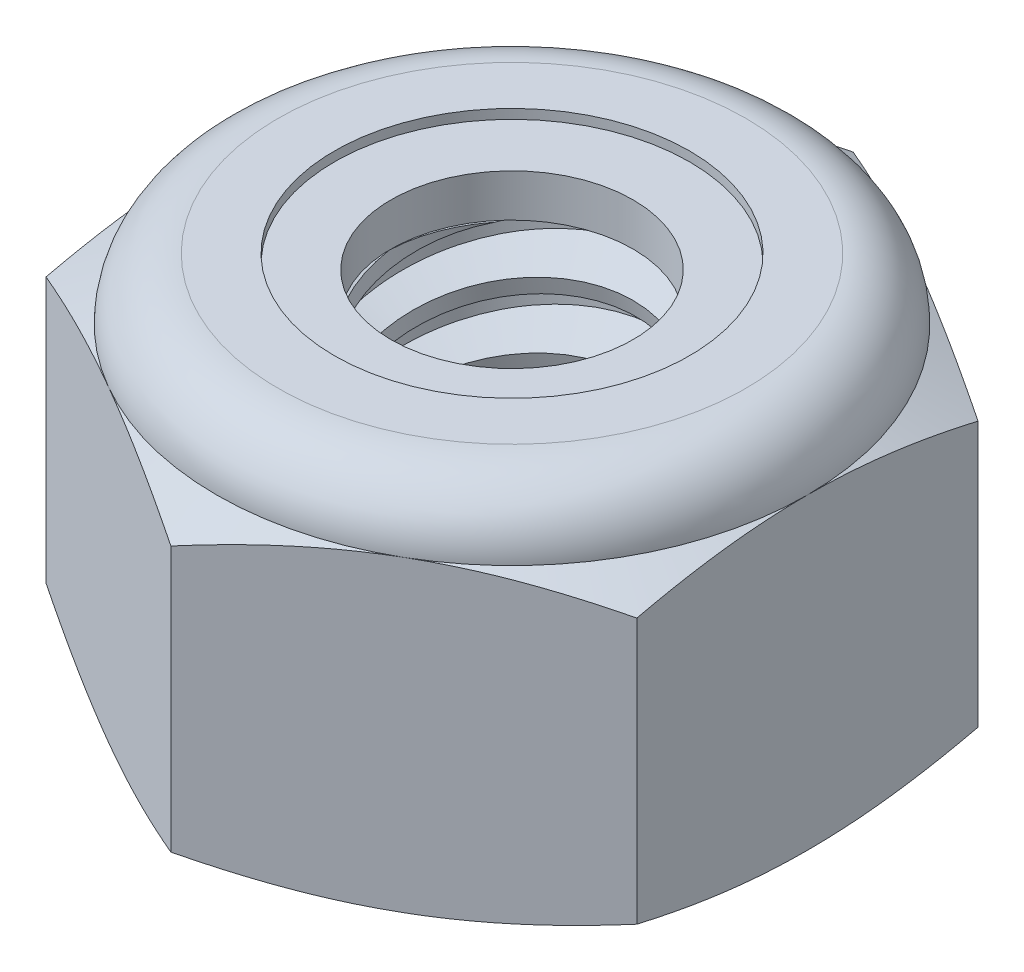
from build123d import *

# Parameters (mm, degrees)
EXTRUDE1_DEPTH      = 5.953125
SKETCH2_W           = 2.413
SKETCH2_H           = 5.953125
LPATTERN1_COUNT     = 6
LPATTERN1_PITCH     = 1.058333333
LPATTERN1_COL_COUNT = 2
LPATTERN1_COL_PITCH = 1.058333333


with BuildPart() as part:
    # Sketch1 → Extrude1 (new body)
    with BuildSketch(Plane(origin=(0, 0, 0), x_dir=(1, 0, 0), z_dir=(0, 1, 0))):
        Polygon((0, 5.499261314), (-4.7625, 2.749630657), (-4.7625, -2.749630657), (0, -5.499261314), (4.7625, -2.749630657), (4.7625, 2.749630657), align=None)
    extrude(amount=EXTRUDE1_DEPTH)

    # Sketch4 → Cut-Revolve2 (revolve, cut)
    with BuildSketch(Plane(origin=(0, 0, 0), x_dir=(0, 0, -1), z_dir=(1, 0, 0)), mode=Mode.PRIVATE) as cut_revolve2_sk:
        Polygon((0, 5.953125), (2.413, 5.953125), (1.952639712, 5.738455472), (1.952639712, 0.214669528), (2.413, 0), (0, 0), align=None)
    revolve(cut_revolve2_sk.sketch.rotate(Axis((0, 5.953125, 0), (0, 1, 0)), 35.702080493), axis=Axis((0, 5.953125, 0), (0, 1, 0)), mode=Mode.SUBTRACT)


with BuildPart() as body_2:
    # Sketch2 → Revolve1 (revolve)
    with BuildSketch(Plane(origin=(0, 0, 0), x_dir=(0, 0, -1), z_dir=(1, 0, 0))):
        with Locations((1.2065, 2.9765625)):
            Rectangle(SKETCH2_W, SKETCH2_H)
    revolve(axis=Axis((0, -2.413, 0), (0, 1, 0)))

    # Sketch3 → Cut-Revolve1 (revolve, cut)
    with BuildSketch(Plane(origin=(0, 0, 0), x_dir=(0, 0, -1), z_dir=(1, 0, 0)), mode=Mode.PRIVATE) as cut_revolve1_sk:
        Polygon((2.441337922, 5.823904076), (2.639703376, 4.919357607), (2.009315556, 5.119703115), (1.952639712, 5.378144964), align=None)
    cut_revolve1 = revolve(cut_revolve1_sk.sketch.rotate(Axis((0, 5.953125, 0.249698658), (0, -0.976788088344826, -0.21420791411070791)), 180), axis=Axis((0, 5.953125, 0.249698658), (0, -0.976788088344826, -0.21420791411070791)), mode=Mode.SUBTRACT)

    # LPattern1: Cut-Revolve1 ×6
    with Locations(*[(0, -i * LPATTERN1_PITCH, 0) for i in range(1, LPATTERN1_COUNT)]):
        add(cut_revolve1, mode=Mode.SUBTRACT)

    # LPattern1 col: Cut-Revolve1 ×2
    with Locations(*[(0, i * LPATTERN1_COL_PITCH, 0) for i in range(1, LPATTERN1_COL_COUNT)]):
        add(cut_revolve1, mode=Mode.SUBTRACT)


with BuildPart() as part_1:
    add(part.part)

    # Combine1: cut body 2
    add(body_2.part, mode=Mode.SUBTRACT)

    # Sketch5 → Cut-Revolve3 (revolve, cut)
    with BuildSketch(Plane(origin=(0, 0, 0), x_dir=(0, 0, -1), z_dir=(1, 0, 0)), mode=Mode.PRIVATE) as cut_revolve3_sk:
        with BuildLine():
            Line((0, 0), (4.7625, 0))
            Line((4.7625, 0), (5.499261314, 0.343557443))
            Line((5.499261314, 0.343557443), (5.499261314, 4.617380057))
            Line((5.499261314, 4.617380057), (4.7625, 4.9609375))
            ThreePointArc((4.7625, 4.9609375), (4.471895009, 5.662520009), (3.7703125, 5.953125))
            Line((3.7703125, 5.953125), (3.7703125, 7.223125))
            Line((3.7703125, 7.223125), (6.769261314, 7.223125))
            Line((6.769261314, 7.223125), (6.769261314, -1.27))
            Line((6.769261314, -1.27), (0, -1.27))
            Line((0, -1.27), (0, 0))
        make_face()
    revolve(cut_revolve3_sk.sketch.rotate(Axis((0, 0, 0), (0, 1, 0)), 47.786997384), axis=Axis((0, 0, 0), (0, 1, 0)), mode=Mode.SUBTRACT)

    # Sketch6 → Cut-Revolve4 (revolve, cut)
    with BuildSketch(Plane(origin=(0, 0, 0), x_dir=(0, 0, -1), z_dir=(1, 0, 0)), mode=Mode.PRIVATE) as cut_revolve4_sk:
        with BuildLine():
            Line((0, 4.9609375), (4.6101, 4.9609375))
            ThreePointArc((4.6101, 4.9609375), (4.364131936, 5.554756936), (3.7703125, 5.800725))
            Line((3.7703125, 5.800725), (2.861476106, 5.800725))
            Line((2.861476106, 5.800725), (2.861476106, 7.223125))
            Line((2.861476106, 7.223125), (0, 7.223125))
            Line((0, 7.223125), (0, 4.9609375))
        make_face()
    revolve(cut_revolve4_sk.sketch.rotate(Axis((0, 7.223125, 0), (0, 1, 0)), 19.898434891), axis=Axis((0, 7.223125, 0), (0, 1, 0)), mode=Mode.SUBTRACT)


with BuildPart() as body_2_2:
    # Sketch7 → Revolve2 (revolve)
    with BuildSketch(Plane(origin=(0, 0, 0), x_dir=(0, 0, -1), z_dir=(1, 0, 0))):
        with BuildLine():
            Line((1.952639712, 5.0371375), (4.530088408, 5.0371375))
            ThreePointArc((4.530088408, 5.0371375), (4.282601726, 5.527175629), (3.7703125, 5.724525))
            Line((3.7703125, 5.724525), (1.952639712, 5.724525))
            Line((1.952639712, 5.724525), (1.952639712, 5.0371375))
        make_face()
    revolve(axis=Axis((0, 5.0371375, 0), (0, 1, 0)))


solid = Compound([part_1.part, body_2_2.part])
